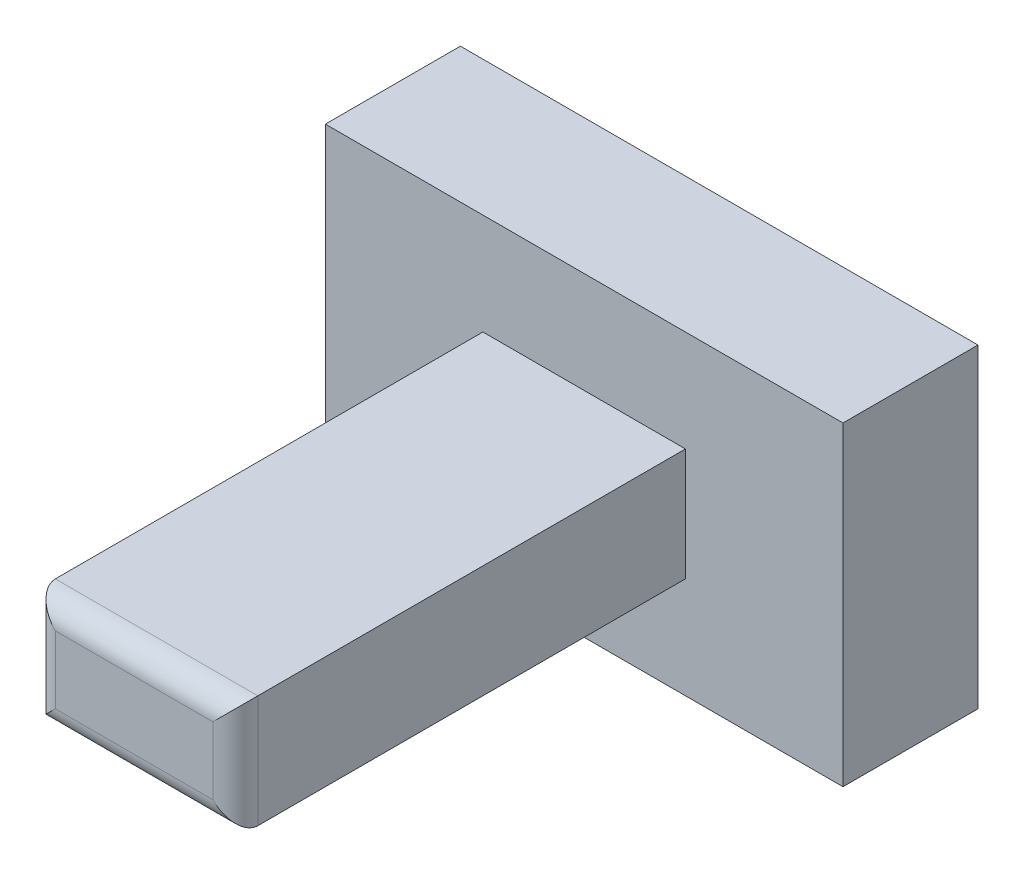
from build123d import *

# Parameters (mm, degrees)
SKIZZE1_W                       = 1.8
SKIZZE1_H                       = 1
AUFSATZ_LINEAR_AUSTRAGEN1_DEPTH = 4
SKIZZE2_W                       = 4.6
SKIZZE2_H                       = 2.8
AUFSATZ_LINEAR_AUSTRAGEN2_DEPTH = 1.2
VERRUNDUNG1_R                   = 0.2


with BuildPart() as part:
    # Skizze1 → Aufsatz-Linear austragen1 (new body)
    with BuildSketch(Plane.XY):
        Rectangle(SKIZZE1_W, SKIZZE1_H)
    extrude(amount=AUFSATZ_LINEAR_AUSTRAGEN1_DEPTH)

    # Skizze2 → Aufsatz-Linear austragen2 (add)
    with BuildSketch(Plane(origin=(0, 0, 0), x_dir=(-1, 0, 0), z_dir=(0, 0, -1))):
        Rectangle(SKIZZE2_W, SKIZZE2_H)
    extrude(amount=AUFSATZ_LINEAR_AUSTRAGEN2_DEPTH)

    # Verrundung1
    verrundung1_edges = [part.edges().sort_by_distance(p)[0] for p in [
        (-0.9, 0, 4),
        (0, -0.5, 4),
        (0.9, 0, 4),
        (0, 0.5, 4),
    ]]
    fillet(verrundung1_edges, radius=VERRUNDUNG1_R)


solid = part.part
